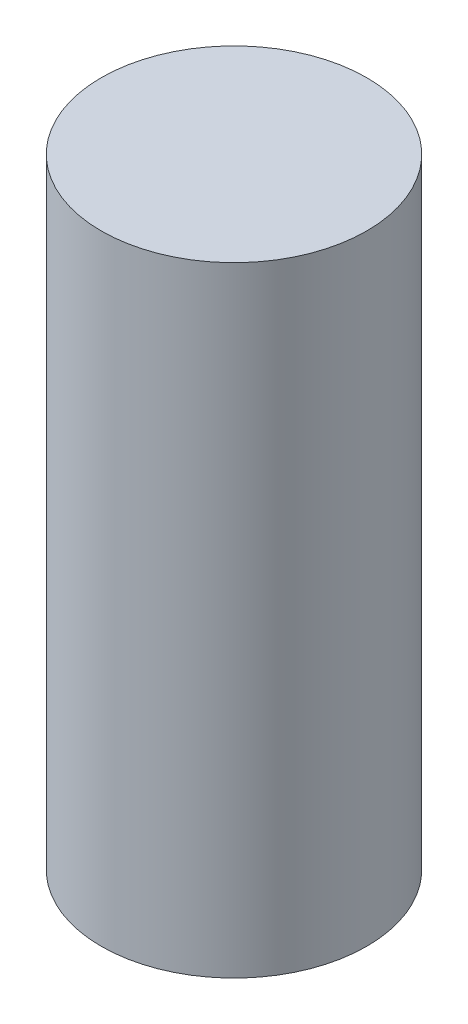
from build123d import *

# Parameters (mm, degrees)
ROLLER_R           = 1.5
BODY_EXTRUDE_DEPTH = 7


with BuildPart() as part:
    # ROLLER → Body Extrude (new body)
    with BuildSketch(Plane(origin=(0, 0, 0), x_dir=(1, 0, 0), z_dir=(0, 1, 0))):
        with Locations(Location((0, 0, 0), (0, 0, 270))):
            Circle(ROLLER_R)
    extrude(amount=BODY_EXTRUDE_DEPTH)


solid = part.part
